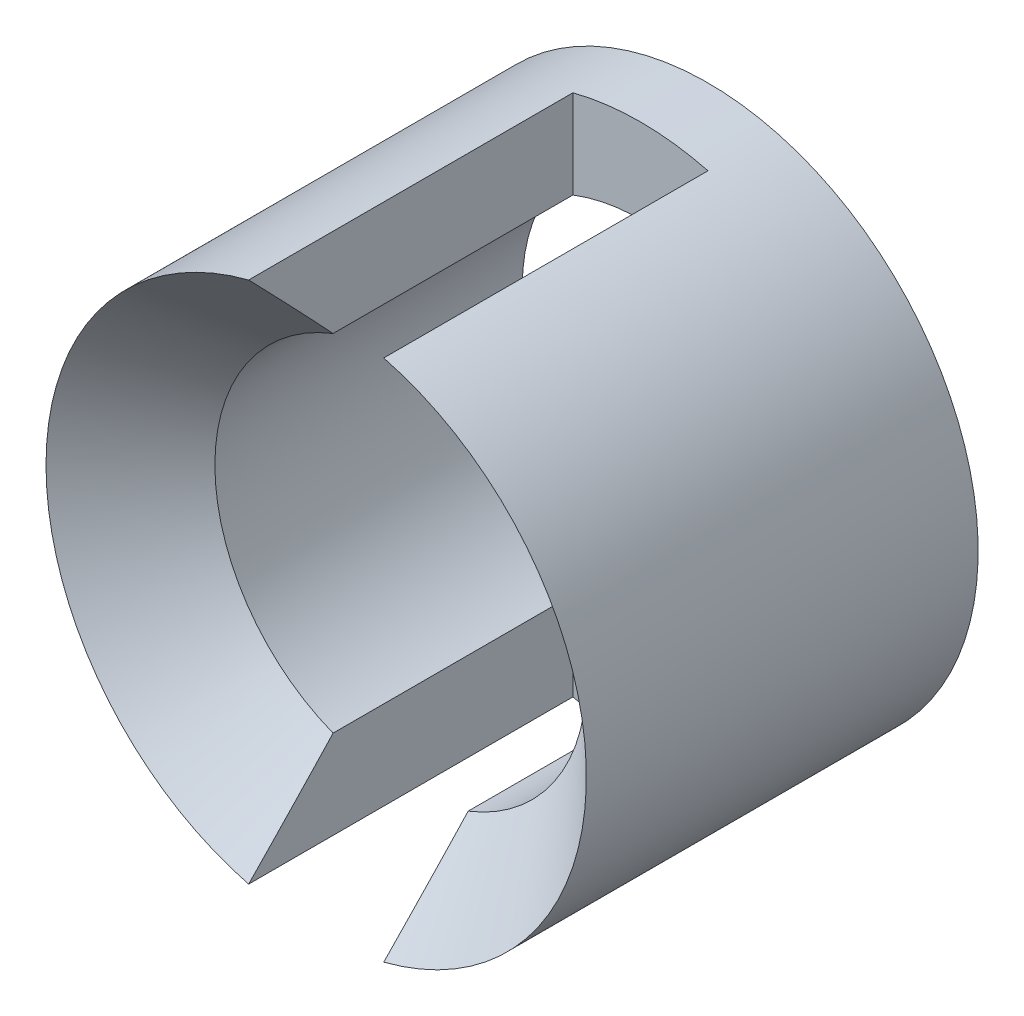
from build123d import *

# Parameters (mm, degrees)
FORMSENKUNG_F_R_M5_LINSENSENKSCHRAUBE_MI_D           = 5.5
FORMSENKUNG_F_R_M5_LINSENSENKSCHRAUBE_MI_CSINK_D     = 10.4
FORMSENKUNG_F_R_M5_LINSENSENKSCHRAUBE_MI_CSINK_ANGLE = 90
SKIZZE7_W                                            = 1
SKIZZE7_H                                            = 6
SCHNITT_LINEAR_AUSTRAGEN1_DEPTH                      = 66.531976927


with BuildPart() as part:
    # Skizze2 → Rotation1 (revolve)
    with BuildSketch(Plane(origin=(0, 0, 0), x_dir=(1, 0, 0), z_dir=(0, 1, 0))):
        Polygon((48, -35), (52, -35), (52, -29), (52, -28), (48, -28), (48, -29), align=None)
    revolve(axis=Axis((52, 0, 29), (0, 0, 1)))

    # Formsenkung für M5 Linsensenkschraube mit Schlitz1 (through all)
    with Locations(Plane.XY.offset(35)):
        with Locations((52, 0)):
            CounterSinkHole(FORMSENKUNG_F_R_M5_LINSENSENKSCHRAUBE_MI_D / 2, FORMSENKUNG_F_R_M5_LINSENSENKSCHRAUBE_MI_CSINK_D / 2, counter_sink_angle=FORMSENKUNG_F_R_M5_LINSENSENKSCHRAUBE_MI_CSINK_ANGLE)

    # Skizze7 → Schnitt-Linear austragen1 (cut, symmetric)
    with BuildSketch(Plane(origin=(0, 0, 0), x_dir=(1, 0, 0), z_dir=(0, 1, 0))):
        with Locations((51.5, -32)):
            Rectangle(SKIZZE7_W, SKIZZE7_H)
    schnitt_linear_austragen1 = extrude(amount=SCHNITT_LINEAR_AUSTRAGEN1_DEPTH, both=True, mode=Mode.SUBTRACT)

    # Spiegeln1: Schnitt-Linear austragen1 across plane
    add(schnitt_linear_austragen1.mirror(Plane(origin=(52, -4, 29), x_dir=(0, 0, 1), z_dir=(1, 0, 0))), mode=Mode.SUBTRACT)


solid = part.part
